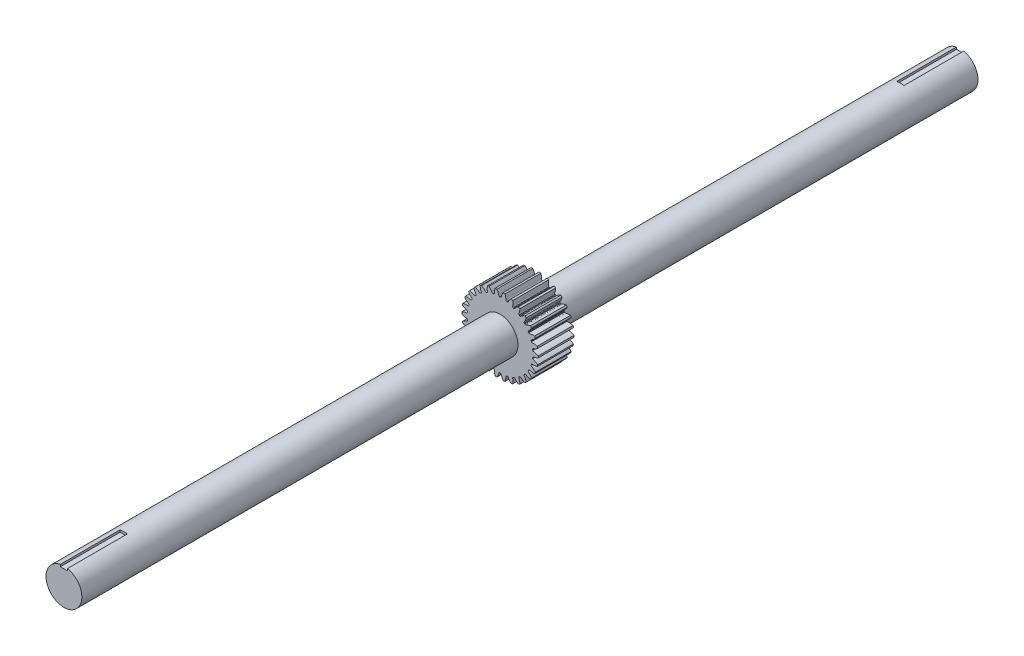
from build123d import *

# Parameters (mm, degrees)
SKETCH_1_R               = 32
EXTRUDE_1_DEPTH          = 30
CUT_EXTRUDE_1_DEPTH      = 55.295487842
PATTERN_CIRCULAR_1_COUNT = 30
SKETCH_4_R               = 15
EXTRUDE_2_DEPTH          = 365
EXTRUDE_START            = 355
SKETCH_5_R               = 15
EXTRUDE_3_DEPTH          = 355
SKETCH_6_W               = 6
SKETCH_6_H               = 50
CUT_EXTRUDE_2_DEPTH      = 2


with BuildPart() as part:
    # 草图1 → 凸台-拉伸1 (new body)
    with BuildSketch(Plane.XY):
        Circle(SKETCH_1_R)
    extrude(amount=EXTRUDE_1_DEPTH)

    # 草图2 → 切除-拉伸1 (cut, through all)
    with BuildSketch(Plane.XY):
        with BuildLine():
            ThreePointArc((0.291117258, 27.498459061), (0, 27.5), (-0.291117258, 27.498459061))
            add(Edge.make_bspline(
                [(-0.291117258, 27.498459061), (-1.016461379, 27.62595034), (-1.020609493, 28.094265272), (-1.11796964, 28.57715803), (-1.139901483, 28.676258475), (-1.166494173, 28.785849819), (-1.198135434, 28.905795984), (-1.235261247, 29.035929815), (-1.278286716, 29.176077028), (-1.327627025, 29.326048954), (-1.383690587, 29.485644922), (-1.446880683, 29.65465171), (-1.517594534, 29.8328439), (-1.596223153, 30.019983966), (-1.683150964, 30.215822454), (-1.778755503, 30.42009815), (-1.883407094, 30.632538255), (-1.99746854, 30.852858572), (-2.121294814, 31.0807637), (-2.255232758, 31.315947232), (-2.399620786, 31.558091968), (-2.554788592, 31.806870128), (-2.721056861, 32.061943577), (-2.89873699, 32.322964055), (-3.088130814, 32.589573415), (-3.289530328, 32.861403867), (-3.503217435, 33.138078232), (-3.729463678, 33.419210196), (-3.968529992, 33.70440458), (-4.220666464, 33.993257607), (-4.486112085, 34.285357181), (-4.765094529, 34.580283169), (-5.057829915, 34.877607694), (-5.364522622, 35.176895427), (-5.685364966, 35.47770389), (-6.137847732, 35.885241657), (-6.490689237, 36.184143062), (-6.732623663, 36.381116246)],
                knots=[0, 0, 0, 0, 0.115323882, 0.12341257, 0.132512303, 0.142623081, 0.153744905, 0.165877774, 0.179021689, 0.193176649, 0.208342655, 0.224519706, 0.241707802, 0.259906945, 0.279117132, 0.299338365, 0.320570644, 0.342813968, 0.366068337, 0.390333752, 0.415610213, 0.441897719, 0.46919627, 0.497505867, 0.52682651, 0.557158198, 0.588500931, 0.62085471, 0.654219534, 0.688595404, 0.723982319, 0.76038028, 0.797789286, 0.836209338, 0.875640435, 0.916082578, 1, 1, 1, 1], degree=3))
            ThreePointArc((-6.732623663, 36.381116246), (0, 36.998835667), (6.732623663, 36.381116246))
            add(Edge.make_bspline(
                [(0.291117258, 27.498459061), (1.016461379, 27.62595034), (1.020609493, 28.094265272), (1.11796964, 28.57715803), (1.139901483, 28.676258475), (1.166494173, 28.785849819), (1.198135434, 28.905795984), (1.235261247, 29.035929815), (1.278286716, 29.176077028), (1.327627025, 29.326048954), (1.383690587, 29.485644922), (1.446880683, 29.65465171), (1.517594534, 29.8328439), (1.596223153, 30.019983966), (1.683150964, 30.215822454), (1.778755503, 30.42009815), (1.883407094, 30.632538255), (1.99746854, 30.852858572), (2.121294814, 31.0807637), (2.255232758, 31.315947232), (2.399620786, 31.558091968), (2.554788592, 31.806870128), (2.721056861, 32.061943577), (2.89873699, 32.322964055), (3.088130814, 32.589573415), (3.289530328, 32.861403867), (3.503217435, 33.138078232), (3.729463678, 33.419210196), (3.968529992, 33.70440458), (4.220666464, 33.993257607), (4.486112085, 34.285357181), (4.765094529, 34.580283169), (5.057829915, 34.877607694), (5.364522622, 35.176895427), (5.685364966, 35.47770389), (6.137847732, 35.885241657), (6.490689237, 36.184143062), (6.732623663, 36.381116246)],
                knots=[0, 0, 0, 0, 0.115323882, 0.12341257, 0.132512303, 0.142623081, 0.153744905, 0.165877774, 0.179021689, 0.193176649, 0.208342655, 0.224519706, 0.241707802, 0.259906945, 0.279117132, 0.299338365, 0.320570644, 0.342813968, 0.366068337, 0.390333752, 0.415610213, 0.441897719, 0.46919627, 0.497505867, 0.52682651, 0.557158198, 0.588500931, 0.62085471, 0.654219534, 0.688595404, 0.723982319, 0.76038028, 0.797789286, 0.836209338, 0.875640435, 0.916082578, 1, 1, 1, 1], degree=3))
        make_face()
    cut_extrude_1 = extrude(amount=CUT_EXTRUDE_1_DEPTH, mode=Mode.SUBTRACT)

    # 阵列(圆周)1: 切除-拉伸1 ×30 about axis
    pattern_circular_1_axis = Axis((0, 0, 30), (0, 0, -1))
    for i in range(1, PATTERN_CIRCULAR_1_COUNT):
        add(cut_extrude_1.rotate(pattern_circular_1_axis, i * 360 / PATTERN_CIRCULAR_1_COUNT), mode=Mode.SUBTRACT)

    # 草图4 → 凸台-拉伸2 (add)
    with BuildSketch(Plane.XY.offset(30)):
        Circle(SKETCH_4_R)
    extrude(amount=EXTRUDE_2_DEPTH)

    # 草图5 → 凸台-拉伸3 (add)
    with BuildSketch(Plane(origin=(0, 0, 0), x_dir=(-1, 0, 0), z_dir=(0, 0, -1)).offset(EXTRUDE_START)):
        Circle(SKETCH_5_R)
    extrude(amount=-EXTRUDE_3_DEPTH)

    # 草图6 → 切除-拉伸2 (cut)
    with BuildSketch(Plane(origin=(0, 15, 0), x_dir=(1, 0, 0), z_dir=(0, 1, 0))):
        with Locations((0, 330)):
            Rectangle(SKETCH_6_W, SKETCH_6_H)
        with Locations((0, -370)):
            Rectangle(SKETCH_6_W, SKETCH_6_H)
    extrude(amount=-CUT_EXTRUDE_2_DEPTH, mode=Mode.SUBTRACT)


solid = part.part
